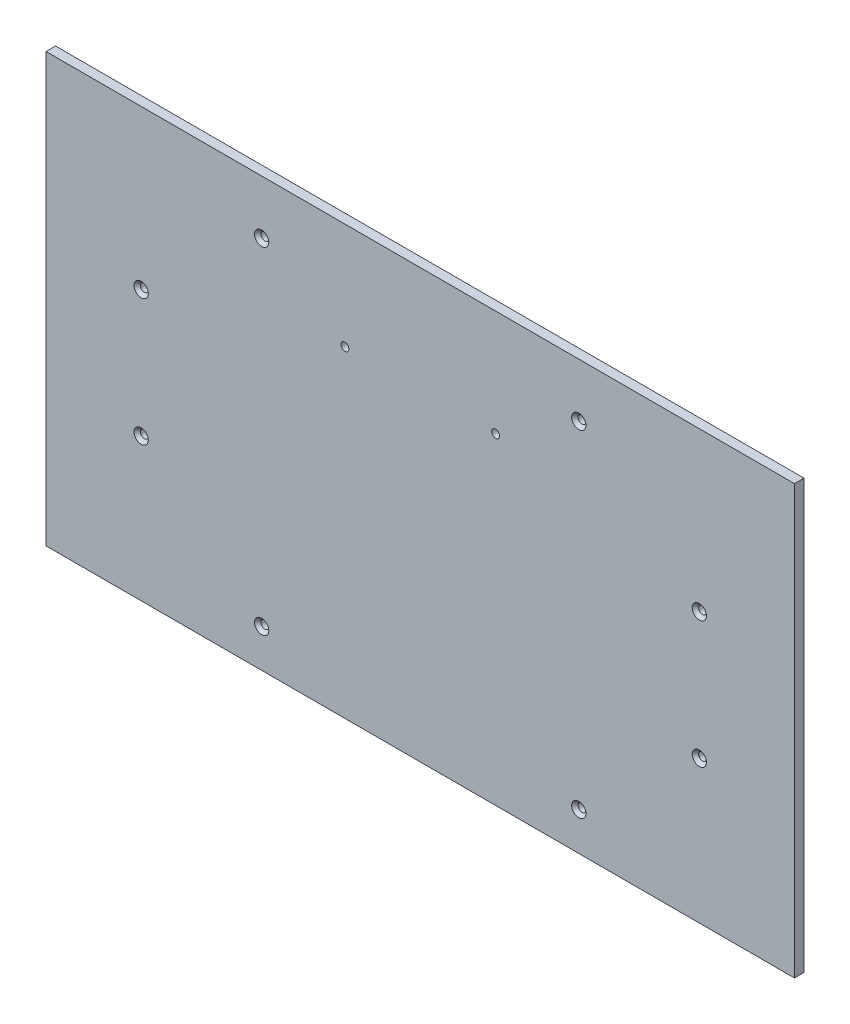
from build123d import *

# Parameters (mm, degrees)
ESQUISSE1_W             = 472
ESQUISSE1_H             = 270
BOSS_EXTRU_1_DEPTH      = 6
ESQUISSE2_R             = 2.5
ENL_V_MAT_EXTRU_1_DEPTH = 272.950363118
CHANFREIN1_SIZE         = 2
ESQUISSE3_R             = 2.5
ENL_V_MAT_EXTRU_2_DEPTH = 272.950363118


with BuildPart() as part:
    # Esquisse1 → Boss.-Extru.1 (new body)
    with BuildSketch(Plane.XY):
        Rectangle(ESQUISSE1_W, ESQUISSE1_H)
    extrude(amount=BOSS_EXTRU_1_DEPTH)

    # Esquisse2 → Enlèv. mat.-Extru.1 (cut, through all)
    with BuildSketch(Plane.XY.offset(6)):
        with Locations((-100, 101)):
            Circle(ESQUISSE2_R)
        with Locations((100, 101)):
            Circle(ESQUISSE2_R)
        with Locations((176, 35)):
            Circle(ESQUISSE2_R)
        with Locations((176, -45)):
            Circle(ESQUISSE2_R)
        with Locations((100, -111)):
            Circle(ESQUISSE2_R)
        with Locations((-100, -111)):
            Circle(ESQUISSE2_R)
        with Locations((-176, -45)):
            Circle(ESQUISSE2_R)
        with Locations((-176, 35)):
            Circle(ESQUISSE2_R)
    extrude(amount=-ENL_V_MAT_EXTRU_1_DEPTH, mode=Mode.SUBTRACT)

    # Chanfrein1
    chanfrein1_edges = [part.edges().sort_by_distance(p)[0] for p in [
        (-178.5, 35, 6),
        (-178.5, -45, 6),
        (-102.5, -111, 6),
        (97.5, -111, 6),
        (173.5, -45, 6),
        (173.5, 35, 6),
        (97.5, 101, 6),
        (-102.5, 101, 6),
    ]]
    chamfer(chanfrein1_edges, length=CHANFREIN1_SIZE)

    # Esquisse3 → Enlèv. mat.-Extru.2 (cut, through all)
    with BuildSketch(Plane.XY.offset(6)):
        with Locations((-47.5, 68)):
            Circle(ESQUISSE3_R)
        with Locations((47.5, 68)):
            Circle(ESQUISSE3_R)
    extrude(amount=-ENL_V_MAT_EXTRU_2_DEPTH, mode=Mode.SUBTRACT)


solid = part.part
